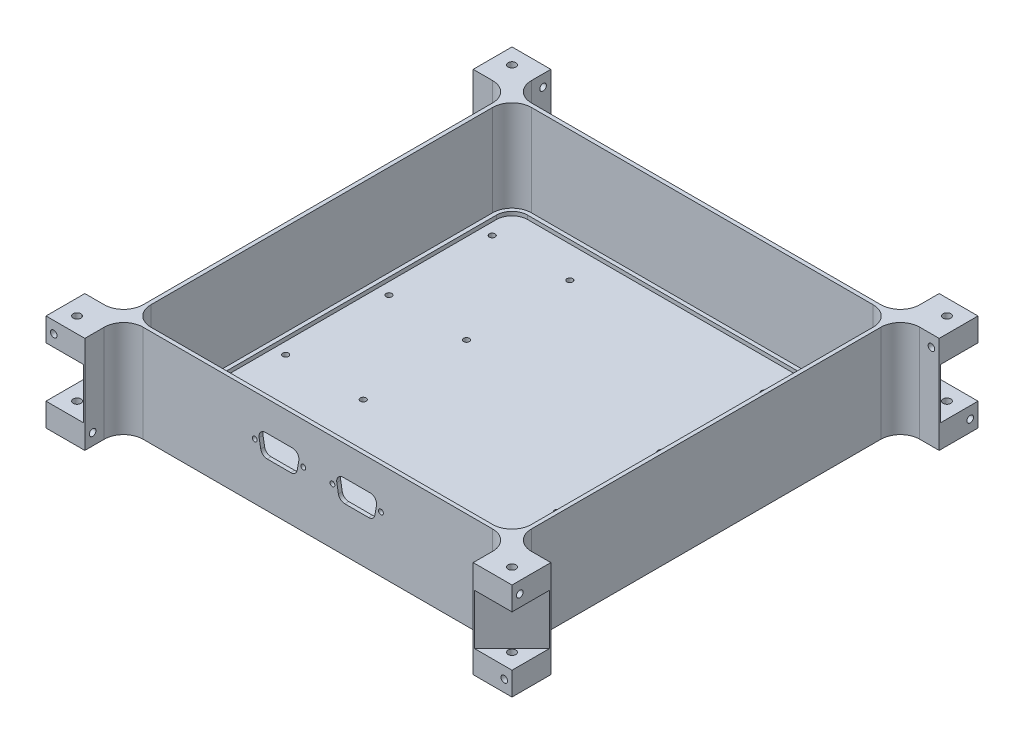
from build123d import *

# Parameters (mm, degrees)
BOSS_EXTRUDE1_DEPTH                = 26
CUT_EXTRUDE1_DEPTH                 = 14
CUT_EXTRUDE2_DEPTH                 = 47
CUT_EXTRUDE3_DEPTH                 = 2
SKETCH5_R                          = 2
CUT_EXTRUDE4_DEPTH                 = 178.493661859
MIRROR2_COPY_1_SKETCH_R            = 2
MIRROR2_COPY_1_DEPTH               = 178.493661859
CUT_EXTRUDE5_DEPTH                 = 12
CUT_EXTRUDE6_START                 = -2
CUT_EXTRUDE6_DEPTH                 = 2
F_3_0_3_DIAMETER_HOLE3_D           = 3
M3_CLEARANCE_HOLE2_D               = 3.4
M3_CLEARANCE_HOLE2_DEPTH           = 20
M3_CLEARANCE_HOLE2_ON_FACE_2_D     = 3.4
M3_CLEARANCE_HOLE2_ON_FACE_2_DEPTH = 20
M3_CLEARANCE_HOLE2_ON_FACE_3_D     = 3.4
M3_CLEARANCE_HOLE2_ON_FACE_3_DEPTH = 20
M3_CLEARANCE_HOLE2_ON_FACE_4_D     = 3.4
M3_CLEARANCE_HOLE2_ON_FACE_4_DEPTH = 20
CUT_EXTRUDE7_DEPTH                 = 10
CUT_EXTRUDE8_DEPTH                 = 10
M3X0_5_TAPPED_HOLE1_D              = 2.5
M3X0_5_TAPPED_HOLE1_DEPTH          = 7.5
M3X0_5_TAPPED_HOLE1_TIP            = 0.751075774


with BuildPart() as part:
    # Sketch1 → Boss-Extrude1 (new, symmetric)
    with BuildSketch(Plane(origin=(0, 0, 0), x_dir=(1, 0, 0), z_dir=(0, 1, 0))):
        with BuildLine():
            Line((-100, 120), (-120, 120))
            Line((-120, 120), (-120, 100))
            Line((-120, 100), (-110, 100))
            ThreePointArc((-110, 100), (-102.928932188, 97.071067812), (-100, 90))
            Line((-100, 90), (-100, 0))
            Line((-100, 0), (-100, -90))
            ThreePointArc((-100, -90), (-102.928932188, -97.071067812), (-110, -100))
            Line((-110, -100), (-120, -100))
            Line((-120, -100), (-120, -120))
            Line((-120, -120), (-100, -120))
            Line((-100, -120), (-100, -110))
            ThreePointArc((-100, -110), (-97.071067812, -102.928932188), (-90, -100))
            Line((-90, -100), (0, -100))
            Line((0, -100), (90, -100))
            ThreePointArc((90, -100), (97.071067812, -102.928932188), (100, -110))
            Line((100, -110), (100, -120))
            Line((100, -120), (120, -120))
            Line((120, -120), (120, -100))
            Line((120, -100), (110, -100))
            ThreePointArc((110, -100), (102.928932188, -97.071067812), (100, -90))
            Line((100, -90), (100, 0))
            Line((100, 0), (100, 90))
            ThreePointArc((100, 90), (102.928932188, 97.071067812), (110, 100))
            Line((110, 100), (120, 100))
            Line((120, 100), (120, 120))
            Line((120, 120), (100, 120))
            Line((100, 120), (100, 110))
            ThreePointArc((100, 110), (97.071067812, 102.928932188), (90, 100))
            Line((90, 100), (0, 100))
            Line((0, 100), (-90, 100))
            ThreePointArc((-90, 100), (-97.071067812, 102.928932188), (-100, 110))
            Line((-100, 110), (-100, 120))
        make_face()
    extrude(amount=BOSS_EXTRUDE1_DEPTH, both=True)

    # Sketch2 → Cut-Extrude1 (cut)
    with BuildSketch(Plane.XZ):
        Polygon((-120, -100.707106781), (-100.707106781, -120), (-120, -120), align=None)
        Polygon((-100.707106781, 120), (-120, 120), (-120, 100.707106781), align=None)
        Polygon((120, 100.707106781), (120, 120), (100.707106781, 120), align=None)
        Polygon((100.707106781, -120), (120, -120), (120, -100.707106781), align=None)
    extrude(amount=-CUT_EXTRUDE1_DEPTH, mode=Mode.SUBTRACT)

    # Sketch3 → Cut-Extrude2 (cut)
    with BuildSketch(Plane(origin=(0, 26, 0), x_dir=(1, 0, 0), z_dir=(0, 1, 0))):
        with BuildLine():
            Line((-88, 98), (88, 98))
            ThreePointArc((88, 98), (95.071067812, 95.071067812), (98, 88))
            Line((98, 88), (98, -88))
            ThreePointArc((98, -88), (95.071067812, -95.071067812), (88, -98))
            Line((88, -98), (-88, -98))
            ThreePointArc((-88, -98), (-95.071067812, -95.071067812), (-98, -88))
            Line((-98, -88), (-98, 88))
            ThreePointArc((-98, 88), (-95.071067812, 95.071067812), (-88, 98))
        make_face()
    extrude(amount=-CUT_EXTRUDE2_DEPTH, mode=Mode.SUBTRACT)

    # Sketch4 → Cut-Extrude3 (cut)
    with BuildSketch(Plane(origin=(0, -21, 0), x_dir=(1, 0, 0), z_dir=(0, 1, 0))):
        with BuildLine():
            Line((-88, -96), (88, -96))
            ThreePointArc((88, -96), (93.656854249, -93.656854249), (96, -88))
            Line((96, -88), (96, 88))
            ThreePointArc((96, 88), (93.656854249, 93.656854249), (88, 96))
            Line((88, 96), (-88, 96))
            ThreePointArc((-88, 96), (-93.656854249, 93.656854249), (-96, 88))
            Line((-96, 88), (-96, -88))
            ThreePointArc((-96, -88), (-93.656854249, -93.656854249), (-88, -96))
        make_face()
    extrude(amount=-CUT_EXTRUDE3_DEPTH, mode=Mode.SUBTRACT)

    # Sketch5 → Cut-Extrude4 (cut, through all)
    with BuildSketch(Plane(origin=(0, 26, 0), x_dir=(1, 0, 0), z_dir=(0, 1, 0))):
        with Locations(Location((-112, 112, 0), (0, 0, 270))):
            Circle(SKETCH5_R)
    cut_extrude4 = extrude(amount=-CUT_EXTRUDE4_DEPTH, mode=Mode.SUBTRACT)

    # Mirror1: Cut-Extrude4 across plane
    add(cut_extrude4.mirror(Plane(origin=(0, 0, 0), x_dir=(0, 0, 1), z_dir=(1, 0, 0))), mode=Mode.SUBTRACT)

    # Mirror2: Cut-Extrude4 across plane
    add(cut_extrude4.mirror(Plane.XY), mode=Mode.SUBTRACT)

    # Mirror2 copy 1 sketch → Mirror2 copy 1 (cut, through all)
    with BuildSketch(Plane(origin=(0, 26, 0), x_dir=(-1, 0, 0), z_dir=(0, 1, 0))):
        with Locations(Location((-112, 112, 0), (0, 0, 270))):
            Circle(MIRROR2_COPY_1_SKETCH_R)
    extrude(amount=-MIRROR2_COPY_1_DEPTH, mode=Mode.SUBTRACT)

    # Sketch2<3> → Cut-Extrude5 (cut)
    with BuildSketch(Plane.XZ):
        Polygon((-120, -100.707106781), (-100.707106781, -120), (-120, -120), align=None)
        Polygon((-100.707106781, 120), (-120, 120), (-120, 100.707106781), align=None)
        Polygon((120, 100.707106781), (120, 120), (100.707106781, 120), align=None)
        Polygon((100.707106781, -120), (120, -120), (120, -100.707106781), align=None)
    extrude(amount=CUT_EXTRUDE5_DEPTH, mode=Mode.SUBTRACT)

    # Sketch14 → Cut-Extrude6 (cut)
    with BuildSketch(Plane.XZ.offset(26).offset(CUT_EXTRUDE6_START)):
        with BuildLine():
            Line((-90, -100), (90, -100))
            ThreePointArc((90, -100), (97.071067812, -102.928932188), (100, -110))
            Line((100, -110), (100, -120))
            Line((100, -120), (120, -120))
            Line((120, -120), (120, -100))
            Line((120, -100), (110, -100))
            ThreePointArc((110, -100), (102.928932188, -97.071067812), (100, -90))
            Line((100, -90), (100, 90))
            ThreePointArc((100, 90), (102.928932188, 97.071067812), (110, 100))
            Line((110, 100), (120, 100))
            Line((120, 100), (120, 120))
            Line((120, 120), (100, 120))
            Line((100, 120), (100, 110))
            ThreePointArc((100, 110), (97.071067812, 102.928932188), (90, 100))
            Line((90, 100), (-90, 100))
            ThreePointArc((-90, 100), (-97.071067812, 102.928932188), (-100, 110))
            Line((-100, 110), (-100, 120))
            Line((-100, 120), (-120, 120))
            Line((-120, 120), (-120, 100))
            Line((-120, 100), (-110, 100))
            ThreePointArc((-110, 100), (-102.928932188, 97.071067812), (-100, 90))
            Line((-100, 90), (-100, -90))
            ThreePointArc((-100, -90), (-102.928932188, -97.071067812), (-110, -100))
            Line((-110, -100), (-120, -100))
            Line((-120, -100), (-120, -120))
            Line((-120, -120), (-100, -120))
            Line((-100, -120), (-100, -110))
            ThreePointArc((-100, -110), (-97.071067812, -102.928932188), (-90, -100))
        make_face()
        with BuildLine():
            Line((-88, 98), (88, 98))
            ThreePointArc((88, 98), (95.071067812, 95.071067812), (98, 88))
            Line((98, 88), (98, -88))
            ThreePointArc((98, -88), (95.071067812, -95.071067812), (88, -98))
            Line((88, -98), (-88, -98))
            ThreePointArc((-88, -98), (-95.071067812, -95.071067812), (-98, -88))
            Line((-98, -88), (-98, 88))
            ThreePointArc((-98, 88), (-95.071067812, 95.071067812), (-88, 98))
        make_face(mode=Mode.SUBTRACT)
    extrude(amount=CUT_EXTRUDE6_DEPTH, mode=Mode.SUBTRACT)

    # Ø3.0 (3) Diameter Hole3 (through all)
    with Locations(Plane(origin=(0, -23, 0), x_dir=(1, 0, 0), z_dir=(0, 1, 0))):
        with Locations((-90, 79.8), (-50, 79.8), (-50, 26.6), (-90, 26.6), (-90, -26.6), (-50, -26.6), (-50, -79.8), (-90, -79.8), (-35.25, -60), (0, -60), (35.25, -60), (50, -79.8), (90, -79.8), (90, -26.6), (50, -26.6), (50, 26.6), (90, 26.6), (90, 79.8), (50, 79.8)):
            Hole(F_3_0_3_DIAMETER_HOLE3_D / 2)

    # M3 Clearance Hole2
    with Locations(Plane(origin=(-116, 20, 120), x_dir=(1, 0, 0), z_dir=(0, 0, 1))):
        with Locations((0, 0), (232, -38)):
            Hole(M3_CLEARANCE_HOLE2_D / 2, depth=M3_CLEARANCE_HOLE2_DEPTH)

    # M3 Clearance Hole2 on face 2
    with Locations(Plane(origin=(120, 20, 116), x_dir=(0, 0, 1), z_dir=(1, 0, 0))):
        with Locations((0, 0), (-232, 38)):
            Hole(M3_CLEARANCE_HOLE2_ON_FACE_2_D / 2, depth=M3_CLEARANCE_HOLE2_ON_FACE_2_DEPTH)

    # M3 Clearance Hole2 on face 3
    with Locations(Plane(origin=(116, 20, -120), x_dir=(-1, 0, 0), z_dir=(0, 0, -1))):
        with Locations((0, 0), (232, -38)):
            Hole(M3_CLEARANCE_HOLE2_ON_FACE_3_D / 2, depth=M3_CLEARANCE_HOLE2_ON_FACE_3_DEPTH)

    # M3 Clearance Hole2 on face 4
    with Locations(Plane(origin=(-120, 20, -116), x_dir=(0, 0, -1), z_dir=(-1, 0, 0))):
        with Locations((0, 0), (-232, 38)):
            Hole(M3_CLEARANCE_HOLE2_ON_FACE_4_D / 2, depth=M3_CLEARANCE_HOLE2_ON_FACE_4_DEPTH)

    # Sketch26 → Cut-Extrude7 (cut)
    with BuildSketch(Plane.XY.offset(100)):
        with BuildLine():
            Line((-26.935894027, 10.57), (-13.064105973, 10.57))
            ThreePointArc((-13.064105973, 10.57), (-10.497857088, 9.373338492), (-9.765, 6.638278605))
            Line((-9.765, 6.638278605), (-10.593736809, 1.938278605))
            ThreePointArc((-10.593736809, 1.938278605), (-11.739504289, -0.046248884), (-13.892842782, -0.83))
            Line((-13.892842782, -0.83), (-26.107157218, -0.83))
            ThreePointArc((-26.107157218, -0.83), (-28.260495711, -0.046248884), (-29.406263191, 1.938278605))
            Line((-29.406263191, 1.938278605), (-30.235, 6.638278605))
            ThreePointArc((-30.235, 6.638278605), (-29.502142912, 9.373338492), (-26.935894027, 10.57))
        make_face()
    extrude(amount=-CUT_EXTRUDE7_DEPTH, mode=Mode.SUBTRACT)

    # Sketch27 → Cut-Extrude8 (cut)
    with BuildSketch(Plane.XY.offset(100)):
        with BuildLine():
            Line((13.064105973, 10.57), (26.935894027, 10.57))
            ThreePointArc((26.935894027, 10.57), (29.502142912, 9.373338492), (30.235, 6.638278605))
            Line((30.235, 6.638278605), (29.406263191, 1.938278605))
            ThreePointArc((29.406263191, 1.938278605), (28.260495711, -0.046248884), (26.107157218, -0.83))
            Line((26.107157218, -0.83), (13.892842782, -0.83))
            ThreePointArc((13.892842782, -0.83), (11.739504289, -0.046248884), (10.593736809, 1.938278605))
            Line((10.593736809, 1.938278605), (9.765, 6.638278605))
            ThreePointArc((9.765, 6.638278605), (10.497857088, 9.373338492), (13.064105973, 10.57))
        make_face()
    extrude(amount=-CUT_EXTRUDE8_DEPTH, mode=Mode.SUBTRACT)

    # M3x0.5 Tapped Hole1
    with Locations(Plane.XY.offset(100)):
        with Locations((-32.495, 4.86), (-7.505, 4.86), (7.505, 4.86), (32.495, 4.86)):
            Hole(M3X0_5_TAPPED_HOLE1_D / 2, depth=M3X0_5_TAPPED_HOLE1_DEPTH)
            with Locations((0, 0, -(M3X0_5_TAPPED_HOLE1_DEPTH + M3X0_5_TAPPED_HOLE1_TIP / 2))):  # 118° drill point
                Cone(0, M3X0_5_TAPPED_HOLE1_D / 2, M3X0_5_TAPPED_HOLE1_TIP, mode=Mode.SUBTRACT)


solid = part.part
